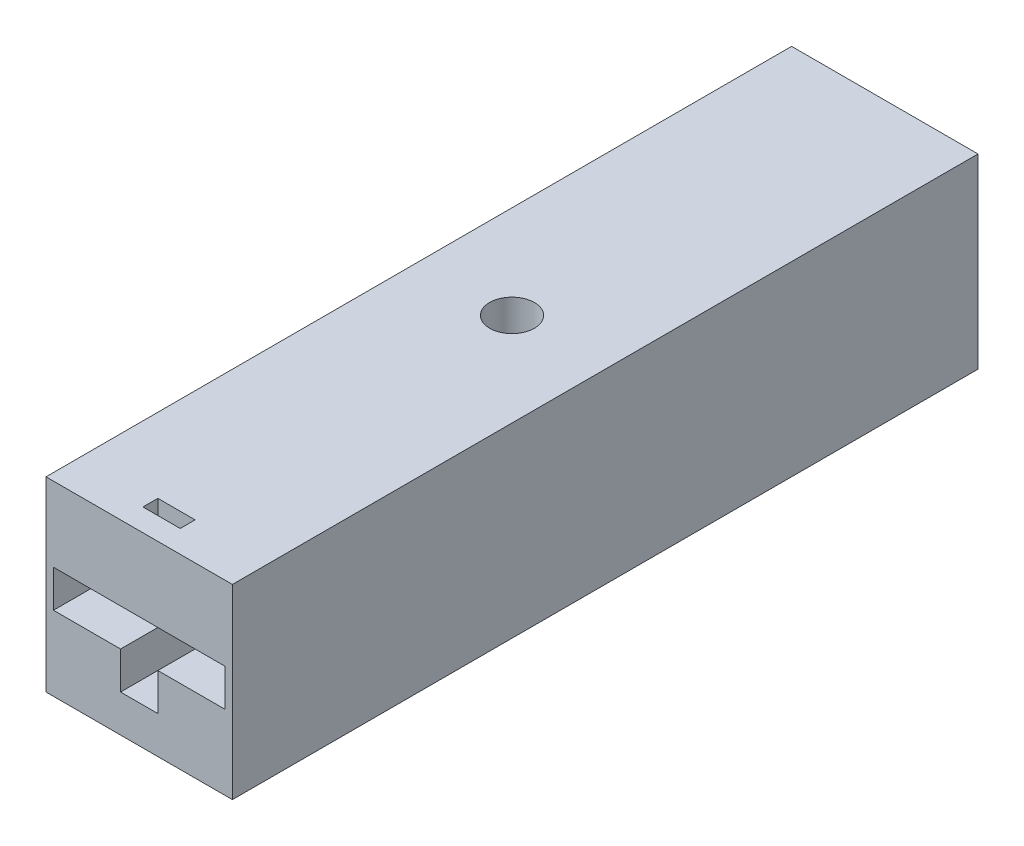
from build123d import *

# Parameters (mm, degrees)
ESQUISSE1_W             = 25
ESQUISSE1_H             = 25
BOSS_EXTRU_1_DEPTH      = 100
ENL_V_MAT_EXTRU_2_DEPTH = 10
ESQUISSE9_R             = 3
ENL_V_MAT_EXTRU_4_DEPTH = 54
ENL_V_MAT_EXTRU_5_DEPTH = 10
ESQUISSE10_W            = 5
ESQUISSE10_H            = 2
ENL_V_MAT_EXTRU_6_DEPTH = 13
ESQUISSE11_W            = 2
ESQUISSE11_H            = 5
ENL_V_MAT_EXTRU_7_DEPTH = 13


with BuildPart() as part:
    # Esquisse1 → Boss.-Extru.1 (new body)
    with BuildSketch(Plane.XY):
        Rectangle(ESQUISSE1_W, ESQUISSE1_H)
    extrude(amount=BOSS_EXTRU_1_DEPTH)

    # Esquisse3 → Enlèv. mat.-Extru.2 (cut)
    with BuildSketch(Plane.XY.offset(100)):
        Polygon((-11.5, 2.5), (11.5, 2.5), (11.5, -2.5), (2.5, -2.5), (2.5, -7.5), (-2.5, -7.5), (-2.5, -2.5), (-11.5, -2.5), align=None)
    extrude(amount=-ENL_V_MAT_EXTRU_2_DEPTH, mode=Mode.SUBTRACT)

    # Esquisse9 → Enlèv. mat.-Extru.4 (cut)
    with BuildSketch(Plane(origin=(0, 12.5, 0), x_dir=(1, 0, 0), z_dir=(0, 1, 0))):
        with Locations(Location((0, -50, 0), (0, 0, 270))):
            Circle(ESQUISSE9_R)
    extrude(amount=-ENL_V_MAT_EXTRU_4_DEPTH, mode=Mode.SUBTRACT)

    # Esquisse4 → Enlèv. mat.-Extru.5 (cut)
    with BuildSketch(Plane.XY):
        Polygon((2.5, 11.5), (-2.5, 11.5), (-2.5, -11.5), (2.5, -11.5), (2.5, -2.5), (7.5, -2.5), (7.5, 2.5), (2.5, 2.5), align=None)
    extrude(amount=ENL_V_MAT_EXTRU_5_DEPTH, mode=Mode.SUBTRACT)

    # Esquisse10 → Enlèv. mat.-Extru.6 (cut)
    with BuildSketch(Plane(origin=(0, 12.5, 0), x_dir=(1, 0, 0), z_dir=(0, 1, 0))):
        with Locations((0, -96)):
            Rectangle(ESQUISSE10_W, ESQUISSE10_H)
    extrude(amount=-ENL_V_MAT_EXTRU_6_DEPTH, mode=Mode.SUBTRACT)

    # Esquisse11 → Enlèv. mat.-Extru.7 (cut)
    with BuildSketch(Plane.ZY.offset(12.5)):
        with Locations((4, 0)):
            Rectangle(ESQUISSE11_W, ESQUISSE11_H)
    extrude(amount=-ENL_V_MAT_EXTRU_7_DEPTH, mode=Mode.SUBTRACT)


solid = part.part
